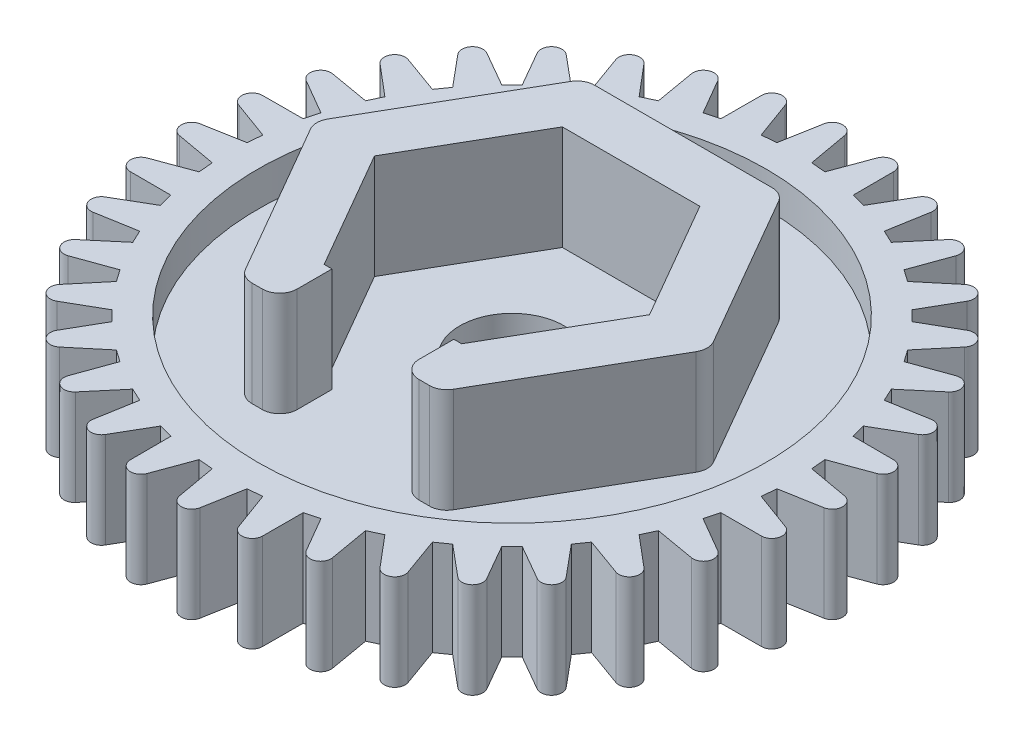
from build123d import *

# Parameters (mm, degrees)
RESSALTO_EXTRUS_O1_DEPTH     = 2.75
FURO_COM_FOLGA_DE_M121_D     = 14.6
FURO_COM_FOLGA_DE_M121_DEPTH = 1
RESSALTO_EXTRUS_O2_DEPTH     = 3
INCLINA_O1_ANGLE             = 15.15090825
INCLINA_O2_ANGLE             = 15.15090825
INCLINA_O3_ANGLE             = 15.15090825
INCLINA_O4_ANGLE             = 15.15090825
INCLINA_O5_ANGLE             = 15.15090825
INCLINA_O6_ANGLE             = 15.15090825
INCLINA_O7_ANGLE             = 15.15090825
INCLINA_O8_ANGLE             = 15.15090825
ESBO_O5_W                    = 7.3
ESBO_O5_H                    = 0.25
FURO_DE_DI_METRO_3_0_3_1_D   = 3
FILETE1_R                    = 0.5


with BuildPart() as part:
    # Esboço1 → Ressalto-extrusão1 (new body)
    with BuildSketch(Plane(origin=(0, 1, 0), x_dir=(1, 0, 0), z_dir=(0, 1, 0))):
        with BuildLine():
            Line((-8.795855883, 2.887173675), (-7.900802719, 2.367266453))
            Line((-7.900802719, 2.367266453), (-7.899573645, 1.900621276))
            Line((-7.899573645, 1.900621276), (-9.061021481, 1.897562194))
            ThreePointArc((-9.061021481, 1.897562194), (-9.355673654, 1.649657688), (-9.163579516, 1.315926674))
            Line((-9.163579516, 1.315926674), (-8.073221822, 0.915813523))
            Line((-8.073221822, 0.915813523), (-8.109600792, 0.5))
            Line((-8.109600792, 0.5), (-9.252872421, 0.295304093))
            ThreePointArc((-9.252872421, 0.295304093), (-9.5, 0), (-9.252872421, -0.295304093))
            Line((-9.252872421, -0.295304093), (-8.109600792, -0.5))
            Line((-8.109600792, -0.5), (-8.073221822, -0.915813523))
            Line((-8.073221822, -0.915813523), (-9.163579516, -1.315926674))
            ThreePointArc((-9.163579516, -1.315926674), (-9.355673654, -1.649657688), (-9.061021481, -1.897562194))
            Line((-9.061021481, -1.897562194), (-7.899573645, -1.900621276))
            Line((-7.899573645, -1.900621276), (-7.900802719, -2.367266453))
            Line((-7.900802719, -2.367266453), (-8.795855883, -2.887173675))
            ThreePointArc((-8.795855883, -2.887173675), (-8.927079897, -3.249191362), (-8.593855987, -3.442163828))
            Line((-8.593855987, -3.442163828), (-7.44952195, -3.243493135))
            Line((-7.44952195, -3.243493135), (-7.2731203, -3.621787694))
            Line((-7.2731203, -3.621787694), (-8.160874621, -4.370695365))
            ThreePointArc((-8.160874621, -4.370695365), (-8.227241336, -4.75), (-7.865570529, -4.882177057))
            Line((-7.865570529, -4.882177057), (-6.7731203, -4.487813098))
            Line((-6.7731203, -4.487813098), (-6.533708427, -4.829728687))
            Line((-6.533708427, -4.829728687), (-7.277929313, -5.721415687))
            ThreePointArc((-7.277929313, -5.721415687), (-7.27742221, -6.106482292), (-6.898293689, -6.173847806))
            Line((-6.898293689, -6.173847806), (-5.890920818, -5.59577313))
            Line((-5.890920818, -5.59577313), (-5.59577313, -5.890920818))
            Line((-5.59577313, -5.890920818), (-6.173847806, -6.898293689))
            ThreePointArc((-6.173847806, -6.898293689), (-6.106482292, -7.27742221), (-5.721415687, -7.277929313))
            Line((-5.721415687, -7.277929313), (-4.829728687, -6.533708427))
            Line((-4.829728687, -6.533708427), (-4.487813098, -6.7731203))
            Line((-4.487813098, -6.7731203), (-4.882177057, -7.865570529))
            ThreePointArc((-4.882177057, -7.865570529), (-4.75, -8.227241336), (-4.370695365, -8.160874621))
            Line((-4.370695365, -8.160874621), (-3.621787694, -7.2731203))
            Line((-3.621787694, -7.2731203), (-3.243493135, -7.44952195))
            Line((-3.243493135, -7.44952195), (-3.442163828, -8.593855987))
            ThreePointArc((-3.442163828, -8.593855987), (-3.249191362, -8.927079897), (-2.887173675, -8.795855883))
            Line((-2.887173675, -8.795855883), (-2.367266453, -7.900802719))
            Line((-2.367266453, -7.900802719), (-1.900621276, -7.899573645))
            Line((-1.900621276, -7.899573645), (-1.897562194, -9.061021481))
            ThreePointArc((-1.897562194, -9.061021481), (-1.649657688, -9.355673654), (-1.315926674, -9.163579516))
            Line((-1.315926674, -9.163579516), (-0.915813523, -8.073221822))
            Line((-0.915813523, -8.073221822), (-0.5, -8.109600792))
            Line((-0.5, -8.109600792), (-0.295304093, -9.252872421))
            ThreePointArc((-0.295304093, -9.252872421), (0, -9.5), (0.295304093, -9.252872421))
            Line((0.295304093, -9.252872421), (0.5, -8.109600792))
            Line((0.5, -8.109600792), (0.915813523, -8.073221822))
            Line((0.915813523, -8.073221822), (1.315926674, -9.163579516))
            ThreePointArc((1.315926674, -9.163579516), (1.649657688, -9.355673654), (1.897562194, -9.061021481))
            Line((1.897562194, -9.061021481), (1.900621276, -7.899573645))
            Line((1.900621276, -7.899573645), (2.367266453, -7.900802719))
            Line((2.367266453, -7.900802719), (2.887173675, -8.795855883))
            ThreePointArc((2.887173675, -8.795855883), (3.249191362, -8.927079897), (3.442163828, -8.593855987))
            Line((3.442163828, -8.593855987), (3.243493135, -7.44952195))
            Line((3.243493135, -7.44952195), (3.621787694, -7.2731203))
            Line((3.621787694, -7.2731203), (4.370695365, -8.160874621))
            ThreePointArc((4.370695365, -8.160874621), (4.75, -8.227241336), (4.882177057, -7.865570529))
            Line((4.882177057, -7.865570529), (4.487813098, -6.7731203))
            Line((4.487813098, -6.7731203), (4.829728687, -6.533708427))
            Line((4.829728687, -6.533708427), (5.721415687, -7.277929313))
            ThreePointArc((5.721415687, -7.277929313), (6.106482292, -7.27742221), (6.173847806, -6.898293689))
            Line((6.173847806, -6.898293689), (5.59577313, -5.890920818))
            Line((5.59577313, -5.890920818), (5.890920818, -5.59577313))
            Line((5.890920818, -5.59577313), (6.898293689, -6.173847806))
            ThreePointArc((6.898293689, -6.173847806), (7.27742221, -6.106482292), (7.277929313, -5.721415687))
            Line((7.277929313, -5.721415687), (6.533708427, -4.829728687))
            Line((6.533708427, -4.829728687), (6.7731203, -4.487813098))
            Line((6.7731203, -4.487813098), (7.865570529, -4.882177057))
            ThreePointArc((7.865570529, -4.882177057), (8.227241336, -4.75), (8.160874621, -4.370695365))
            Line((8.160874621, -4.370695365), (7.2731203, -3.621787694))
            Line((7.2731203, -3.621787694), (7.44952195, -3.243493135))
            Line((7.44952195, -3.243493135), (8.593855987, -3.442163828))
            ThreePointArc((8.593855987, -3.442163828), (8.927079897, -3.249191362), (8.795855883, -2.887173675))
            Line((8.795855883, -2.887173675), (7.900802719, -2.367266453))
            Line((7.900802719, -2.367266453), (7.899573645, -1.900621276))
            Line((7.899573645, -1.900621276), (9.061021481, -1.897562194))
            ThreePointArc((9.061021481, -1.897562194), (9.355673654, -1.649657688), (9.163579516, -1.315926674))
            Line((9.163579516, -1.315926674), (8.073221822, -0.915813523))
            Line((8.073221822, -0.915813523), (8.109600792, -0.5))
            Line((8.109600792, -0.5), (9.252872421, -0.295304093))
            ThreePointArc((9.252872421, -0.295304093), (9.5, 0), (9.252872421, 0.295304093))
            Line((9.252872421, 0.295304093), (8.109600792, 0.5))
            Line((8.109600792, 0.5), (8.073221822, 0.915813523))
            Line((8.073221822, 0.915813523), (9.163579516, 1.315926674))
            ThreePointArc((9.163579516, 1.315926674), (9.355673654, 1.649657688), (9.061021481, 1.897562194))
            Line((9.061021481, 1.897562194), (7.899573645, 1.900621276))
            Line((7.899573645, 1.900621276), (7.900802719, 2.367266453))
            Line((7.900802719, 2.367266453), (8.795855883, 2.887173675))
            ThreePointArc((8.795855883, 2.887173675), (8.927079897, 3.249191362), (8.593855987, 3.442163828))
            Line((8.593855987, 3.442163828), (7.44952195, 3.243493135))
            Line((7.44952195, 3.243493135), (7.2731203, 3.621787694))
            Line((7.2731203, 3.621787694), (8.160874621, 4.370695365))
            ThreePointArc((8.160874621, 4.370695365), (8.227241336, 4.75), (7.865570529, 4.882177057))
            Line((7.865570529, 4.882177057), (6.7731203, 4.487813098))
            Line((6.7731203, 4.487813098), (6.533708427, 4.829728687))
            Line((6.533708427, 4.829728687), (7.277929313, 5.721415687))
            ThreePointArc((7.277929313, 5.721415687), (7.27742221, 6.106482292), (6.898293689, 6.173847806))
            Line((6.898293689, 6.173847806), (5.890920818, 5.59577313))
            Line((5.890920818, 5.59577313), (5.59577313, 5.890920818))
            Line((5.59577313, 5.890920818), (6.173847806, 6.898293689))
            ThreePointArc((6.173847806, 6.898293689), (6.106482292, 7.27742221), (5.721415687, 7.277929313))
            Line((5.721415687, 7.277929313), (4.829728687, 6.533708427))
            Line((4.829728687, 6.533708427), (4.487813098, 6.7731203))
            Line((4.487813098, 6.7731203), (4.882177057, 7.865570529))
            ThreePointArc((4.882177057, 7.865570529), (4.75, 8.227241336), (4.370695365, 8.160874621))
            Line((4.370695365, 8.160874621), (3.621787694, 7.2731203))
            Line((3.621787694, 7.2731203), (3.243493135, 7.44952195))
            Line((3.243493135, 7.44952195), (3.442163828, 8.593855987))
            ThreePointArc((3.442163828, 8.593855987), (3.249191362, 8.927079897), (2.887173675, 8.795855883))
            Line((2.887173675, 8.795855883), (2.367266453, 7.900802719))
            Line((2.367266453, 7.900802719), (1.900621276, 7.899573645))
            Line((1.900621276, 7.899573645), (1.897562194, 9.061021481))
            ThreePointArc((1.897562194, 9.061021481), (1.649657688, 9.355673654), (1.315926674, 9.163579516))
            Line((1.315926674, 9.163579516), (0.915813523, 8.073221822))
            Line((0.915813523, 8.073221822), (0.5, 8.109600792))
            Line((0.5, 8.109600792), (0.295304093, 9.252872421))
            ThreePointArc((0.295304093, 9.252872421), (0, 9.5), (-0.295304093, 9.252872421))
            Line((-0.295304093, 9.252872421), (-0.5, 8.109600792))
            Line((-0.5, 8.109600792), (-0.915813523, 8.073221822))
            Line((-0.915813523, 8.073221822), (-1.315926674, 9.163579516))
            ThreePointArc((-1.315926674, 9.163579516), (-1.649657688, 9.355673654), (-1.897562194, 9.061021481))
            Line((-1.897562194, 9.061021481), (-1.900621276, 7.899573645))
            Line((-1.900621276, 7.899573645), (-2.367266453, 7.900802719))
            Line((-2.367266453, 7.900802719), (-2.887173675, 8.795855883))
            ThreePointArc((-2.887173675, 8.795855883), (-3.249191362, 8.927079897), (-3.442163828, 8.593855987))
            Line((-3.442163828, 8.593855987), (-3.243493135, 7.44952195))
            Line((-3.243493135, 7.44952195), (-3.621787694, 7.2731203))
            Line((-3.621787694, 7.2731203), (-4.370695365, 8.160874621))
            ThreePointArc((-4.370695365, 8.160874621), (-4.75, 8.227241336), (-4.882177057, 7.865570529))
            Line((-4.882177057, 7.865570529), (-4.487813098, 6.7731203))
            Line((-4.487813098, 6.7731203), (-4.829728687, 6.533708427))
            Line((-4.829728687, 6.533708427), (-5.721415687, 7.277929313))
            ThreePointArc((-5.721415687, 7.277929313), (-6.106482292, 7.27742221), (-6.173847806, 6.898293689))
            Line((-6.173847806, 6.898293689), (-5.59577313, 5.890920818))
            Line((-5.59577313, 5.890920818), (-5.890920818, 5.59577313))
            Line((-5.890920818, 5.59577313), (-6.898293689, 6.173847806))
            ThreePointArc((-6.898293689, 6.173847806), (-7.27742221, 6.106482292), (-7.277929313, 5.721415687))
            Line((-7.277929313, 5.721415687), (-6.533708427, 4.829728687))
            Line((-6.533708427, 4.829728687), (-6.7731203, 4.487813098))
            Line((-6.7731203, 4.487813098), (-7.865570529, 4.882177057))
            ThreePointArc((-7.865570529, 4.882177057), (-8.227241336, 4.75), (-8.160874621, 4.370695365))
            Line((-8.160874621, 4.370695365), (-7.2731203, 3.621787694))
            Line((-7.2731203, 3.621787694), (-7.44952195, 3.243493135))
            Line((-7.44952195, 3.243493135), (-8.593855987, 3.442163828))
            ThreePointArc((-8.593855987, 3.442163828), (-8.927079897, 3.249191362), (-8.795855883, 2.887173675))
        make_face()
    extrude(amount=-RESSALTO_EXTRUS_O1_DEPTH)

    # Furo com folga de M121
    with Locations(Plane(origin=(0, 1, 0), x_dir=(1, 0, 0), z_dir=(0, 1, 0))):
        with Locations((0, 0)):
            Hole(FURO_COM_FOLGA_DE_M121_D / 2, depth=FURO_COM_FOLGA_DE_M121_DEPTH)

    # Esboço4 → Ressalto-extrusão2 (add)
    with BuildSketch(Plane(origin=(0, 0, 0), x_dir=(-1, 0, 0), z_dir=(0, 1, 0))):
        Polygon((1.75, 4.920800345), (2.841025404, 4.920800345), (5.682050808, 0), (2.841025404, -4.920800345), (-2.841025404, -4.920800345), (-5.682050808, 0), (-2.841025404, 4.920800345), (-1.75, 4.920800345), (-1.75, 3.420800345), (-1.975, 3.420800345), (-3.95, 0), (-1.975, -3.420800345), (1.975, -3.420800345), (3.95, 0), (1.975, 3.420800345), (1.75, 3.420800345), align=None)
    extrude(amount=RESSALTO_EXTRUS_O2_DEPTH)

    # Inclinação1
    inclina_o1_faces = [part.faces().sort_by_distance(p)[0] for p in [
        (2.133943864, -0.375, -7.900188182),
    ]]
    draft(inclina_o1_faces, Plane(origin=(1.900621276, -1.75, -7.899573645), x_dir=(0.0026338427892489977, 0, 0.9999965314300653), z_dir=(0.9999965314300653, 0, -0.0026338427892489977)), INCLINA_O1_ANGLE)

    # Inclinação2
    inclina_o2_faces = [part.faces().sort_by_distance(p)[0] for p in [
        (7.900188182, -0.375, -2.133943864),
    ]]
    draft(inclina_o2_faces, Plane(origin=(9.061021481, -1.75, -1.897562194), x_dir=(-0.9999965314300653, 0, -0.002633842789259577), z_dir=(0.002633842789259577, 0, -0.9999965314300653)), INCLINA_O2_ANGLE)

    # Inclinação3
    inclina_o3_faces = [part.faces().sort_by_distance(p)[0] for p in [
        (7.900188182, -0.375, 2.133943864),
    ]]
    draft(inclina_o3_faces, Plane(origin=(7.899573645, -1.75, 1.900621276), x_dir=(0.9999965314300653, 0, -0.0026338427892647117), z_dir=(0.0026338427892647117, 0, 0.9999965314300653)), INCLINA_O3_ANGLE)

    # Inclinação4
    inclina_o4_faces = [part.faces().sort_by_distance(p)[0] for p in [
        (2.133943864, -0.375, 7.900188182),
    ]]
    draft(inclina_o4_faces, Plane(origin=(1.897562194, -1.75, 9.061021481), x_dir=(-0.0026338427892532916, 0, 0.9999965314300653), z_dir=(0.9999965314300653, 0, 0.0026338427892532916)), INCLINA_O4_ANGLE)

    # Inclinação5
    inclina_o5_faces = [part.faces().sort_by_distance(p)[0] for p in [
        (-2.133943864, -0.375, 7.900188182),
    ]]
    draft(inclina_o5_faces, Plane(origin=(-1.900621276, -1.75, 7.899573645), x_dir=(-0.0026338427892532916, 0, -0.9999965314300653), z_dir=(-0.9999965314300653, 0, 0.0026338427892532916)), INCLINA_O5_ANGLE)

    # Inclinação6
    inclina_o6_faces = [part.faces().sort_by_distance(p)[0] for p in [
        (-7.900188182, -0.375, 2.133943864),
    ]]
    draft(inclina_o6_faces, Plane(origin=(-9.061021481, -1.75, 1.897562194), x_dir=(0.9999965314300653, 0, 0.0026338427892532916), z_dir=(-0.0026338427892532916, 0, 0.9999965314300653)), INCLINA_O6_ANGLE)

    # Inclinação7
    inclina_o7_faces = [part.faces().sort_by_distance(p)[0] for p in [
        (-7.900188182, -0.375, -2.133943864),
    ]]
    draft(inclina_o7_faces, Plane(origin=(-7.899573645, -1.75, -1.900621276), x_dir=(-0.9999965314300653, 0, 0.0026338427892532916), z_dir=(-0.0026338427892532916, 0, -0.9999965314300653)), INCLINA_O7_ANGLE)

    # Inclinação8
    inclina_o8_faces = [part.faces().sort_by_distance(p)[0] for p in [
        (-2.133943864, -0.375, -7.900188182),
    ]]
    draft(inclina_o8_faces, Plane(origin=(-1.897562194, -1.75, -9.061021481), x_dir=(0.0026338427892532916, 0, -0.9999965314300653), z_dir=(-0.9999965314300653, 0, -0.0026338427892532916)), INCLINA_O8_ANGLE)

    # Esboço5 → Revolução1 (revolve)
    with BuildSketch(Plane(origin=(0, 0, 0), x_dir=(-1, 0, 0), z_dir=(0, 0, -1)), mode=Mode.PRIVATE) as revolu_o1_sk:
        with Locations((-3.65, -1.875)):
            Rectangle(ESBO_O5_W, ESBO_O5_H)
    revolve(revolu_o1_sk.sketch.rotate(Axis((0, -2, 0), (0, 1, 0)), 270), axis=Axis((0, -2, 0), (0, 1, 0)))

    # Furo de diâmetro Ø3.0 (3)1 (through all)
    with Locations(Plane(origin=(0, 0, 0), x_dir=(1, 0, 0), z_dir=(0, 1, 0))):
        with Locations((0, 0)):
            Hole(FURO_DE_DI_METRO_3_0_3_1_D / 2)

    # Filete1
    filete1_edges = [part.edges().sort_by_distance(p)[0] for p in [
        (-1.75, 1.5, 4.920800345),
        (1.75, 1.5, 4.920800345),
        (2.841025404, 1.5, 4.920800345),
        (5.682050808, 1.5, 0),
        (2.841025404, 1.5, -4.920800345),
        (-2.841025404, 1.5, -4.920800345),
        (-5.682050808, 1.5, 0),
        (-2.841025404, 1.5, 4.920800345),
    ]]
    fillet(filete1_edges, radius=FILETE1_R)


solid = part.part
